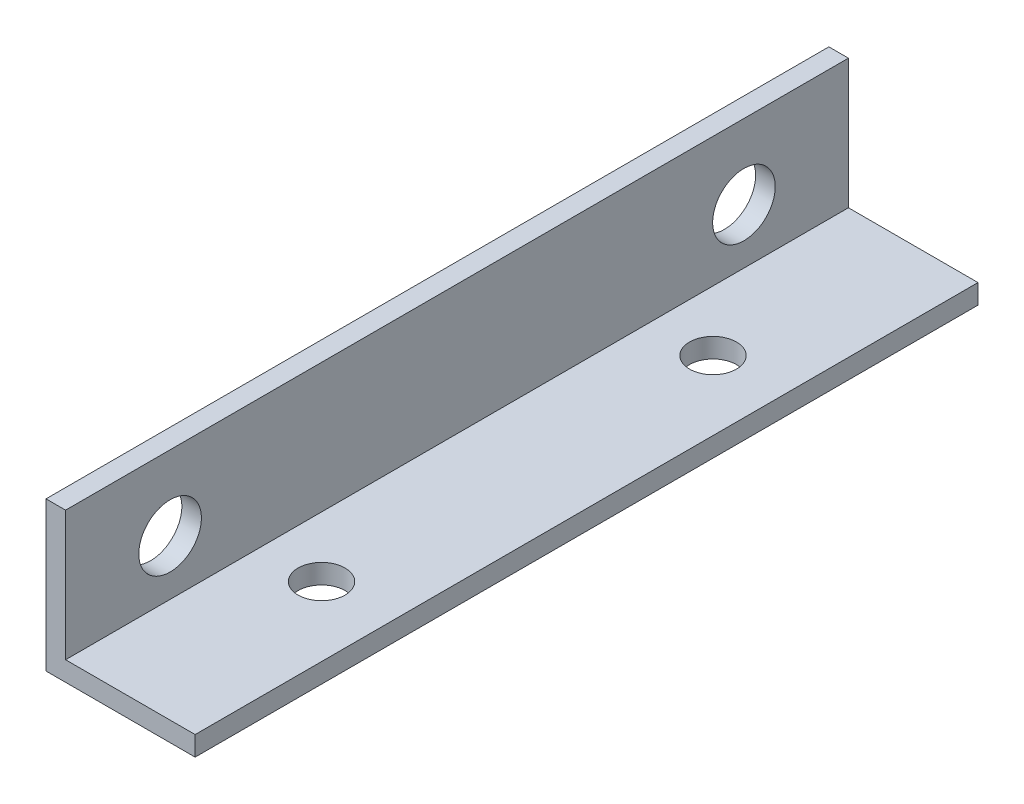
from build123d import *

# Parameters (mm, degrees)
EXTRUDE_THIN1_DEPTH = 50
CUT_EXTRUDE2_REACH  = 58.796
SKETCH4_R           = 4
SKETCH5_R           = 3
CUT_EXTRUDE3_DEPTH  = 57.796170646


with BuildPart() as part:
    # Sketch1 → Extrude-Thin1 (new, symmetric)
    with BuildSketch(Plane.XY):
        Polygon((19.05, 0), (0, 0), (0, 19.05), (2.5, 19.05), (2.5, 2.5), (19.05, 2.5), align=None)
    extrude(amount=EXTRUDE_THIN1_DEPTH, both=True)

    # Sketch4 → Cut-Extrude2 (cut, up to next)
    with BuildSketch(Plane.ZY, mode=Mode.PRIVATE) as cut_extrude2_sk1:
        with Locations((-36.65, 9.525)):
            Circle(SKETCH4_R)
    cut_extrude2_tool1 = extrude(cut_extrude2_sk1.sketch, amount=-CUT_EXTRUDE2_REACH, mode=Mode.PRIVATE) & part.part
    # Sketch4 → Cut-Extrude2 (cut, up to next)
    with BuildSketch(Plane.ZY, mode=Mode.PRIVATE) as cut_extrude2_sk2:
        with Locations((36.65, 9.525)):
            Circle(SKETCH4_R)
    cut_extrude2_tool2 = extrude(cut_extrude2_sk2.sketch, amount=-CUT_EXTRUDE2_REACH, mode=Mode.PRIVATE) & part.part
    add(cut_extrude2_tool1.solids().sort_by_distance((0, 9.525, -36.65))[0], mode=Mode.SUBTRACT)
    add(cut_extrude2_tool2.solids().sort_by_distance((0, 9.525, 36.65))[0], mode=Mode.SUBTRACT)

    # Sketch5 → Cut-Extrude3 (cut, through all)
    with BuildSketch(Plane.XZ):
        with Locations(Location((10.2, 25, 0), (0, 0, 270))):
            Circle(SKETCH5_R)
        with Locations(Location((10.2, -25, 0), (0, 0, 270))):
            Circle(SKETCH5_R)
    extrude(amount=-CUT_EXTRUDE3_DEPTH, mode=Mode.SUBTRACT)


solid = part.part
